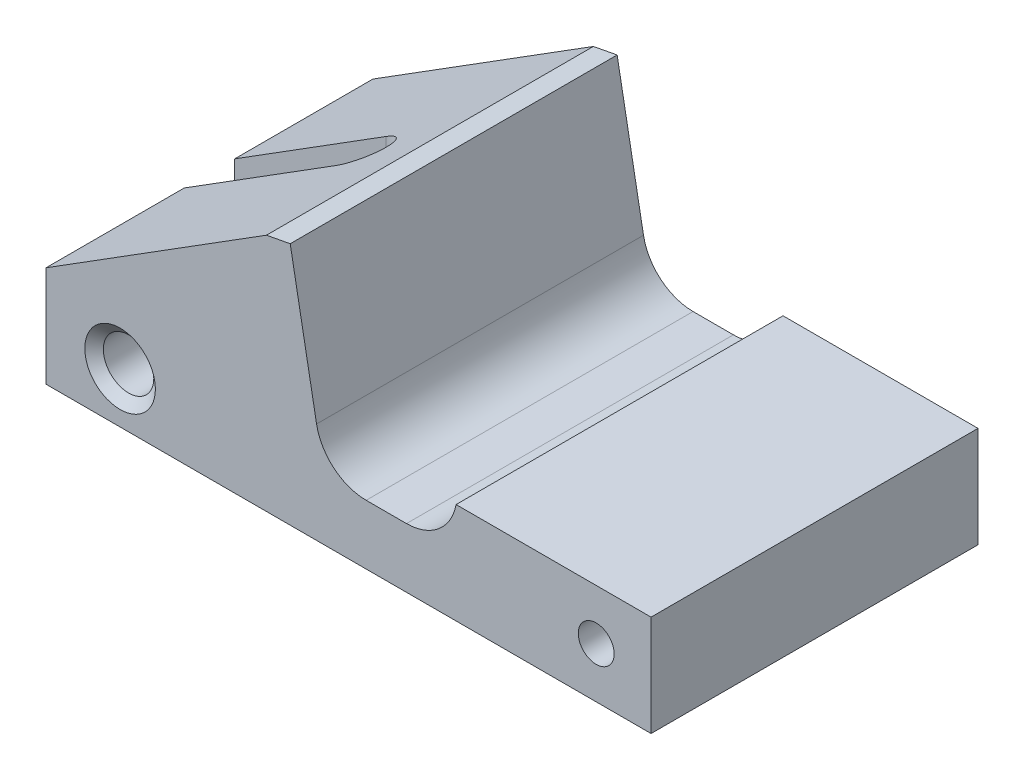
from build123d import *

# Parameters (mm, degrees)
BOSS_EXTRUDE1_START                    = 1.27
SKETCH1_W                              = 38.1
SKETCH1_H                              = 6.35
BOSS_EXTRUDE1_DEPTH                    = 20.586143296
CUT_EXTRUDE1_DEPTH                     = 107.523584385
F_1_8_0_125_DIAMETER_HOLE1_D           = 3.175
F_1_8_0_125_DIAMETER_HOLE1_CSINK_D     = 4.445
F_1_8_0_125_DIAMETER_HOLE1_CSINK_ANGLE = 100
F_4_40_TAPPED_HOLE1_D                  = 2.2606
CUT_EXTRUDE2_DEPTH                     = 110.063554584


with BuildPart() as part:
    # Sketch1 → Boss-Extrude1 (new body)
    with BuildSketch(Plane.XY.offset(BOSS_EXTRUDE1_START)):
        with Locations((-57.517034371, -71.715312393)):
            Rectangle(SKETCH1_W, SKETCH1_H)
        Polygon((-62.686491947, -59.823500591), (-76.567034371, -68.540312393), (-59.530062968, -68.540312393), (-61.189226937, -59.539293818), align=None)
        Polygon((-59.530062968, -68.540312393), (-76.567034371, -68.540312393), (-76.567034371, -74.890312393), (-38.467034371, -74.890312393), (-38.467034371, -68.540312393), align=None)
    extrude(amount=BOSS_EXTRUDE1_DEPTH)

    # Sketch2 → Cut-Extrude1 (cut, through all)
    with BuildSketch(Plane(origin=(26.553910442, -74.890312393, 0), x_dir=(1, 0, 0), z_dir=(0, 1, 0))):
        with BuildLine():
            Line((-103.120944813, -13.150571648), (-93.595944813, -13.150571648))
            ThreePointArc((-93.595944813, -13.150571648), (-92.008444813, -11.563071648), (-93.595944813, -9.975571648))
            Line((-93.595944813, -9.975571648), (-103.120944813, -9.975571648))
            ThreePointArc((-103.120944813, -9.975571648), (-104.708444813, -11.563071648), (-103.120944813, -13.150571648))
        make_face()
    extrude(amount=CUT_EXTRUDE1_DEPTH, mode=Mode.SUBTRACT)

    # 1/8 (0.125) Diameter Hole1 (through all)
    with Locations(Plane.XY.offset(21.856143296)):
        with Locations((-71.901359776, -71.715312393)):
            CounterSinkHole(F_1_8_0_125_DIAMETER_HOLE1_D / 2, F_1_8_0_125_DIAMETER_HOLE1_CSINK_D / 2, counter_sink_angle=F_1_8_0_125_DIAMETER_HOLE1_CSINK_ANGLE)

    # #4-40 Tapped Hole1 (through all)
    with Locations(Plane.XY.offset(21.856143296)):
        with Locations((-41.921434371, -71.715312393)):
            Hole(F_4_40_TAPPED_HOLE1_D / 2)

    # Sketch7 → Cut-Extrude2 (cut, through all)
    with BuildSketch(Plane.XY.offset(21.856143296)):
        with BuildLine():
            Line((-53.867665963, -71.139758797), (-56.407665963, -71.139758797))
            ThreePointArc((-56.407665963, -71.139758797), (-59.582665963, -67.964758797), (-56.407665963, -64.789758797))
            Line((-56.407665963, -64.789758797), (-53.867665963, -64.789758797))
            ThreePointArc((-53.867665963, -64.789758797), (-50.692665963, -67.964758797), (-53.867665963, -71.139758797))
        make_face()
    extrude(amount=-CUT_EXTRUDE2_DEPTH, mode=Mode.SUBTRACT)


solid = part.part
